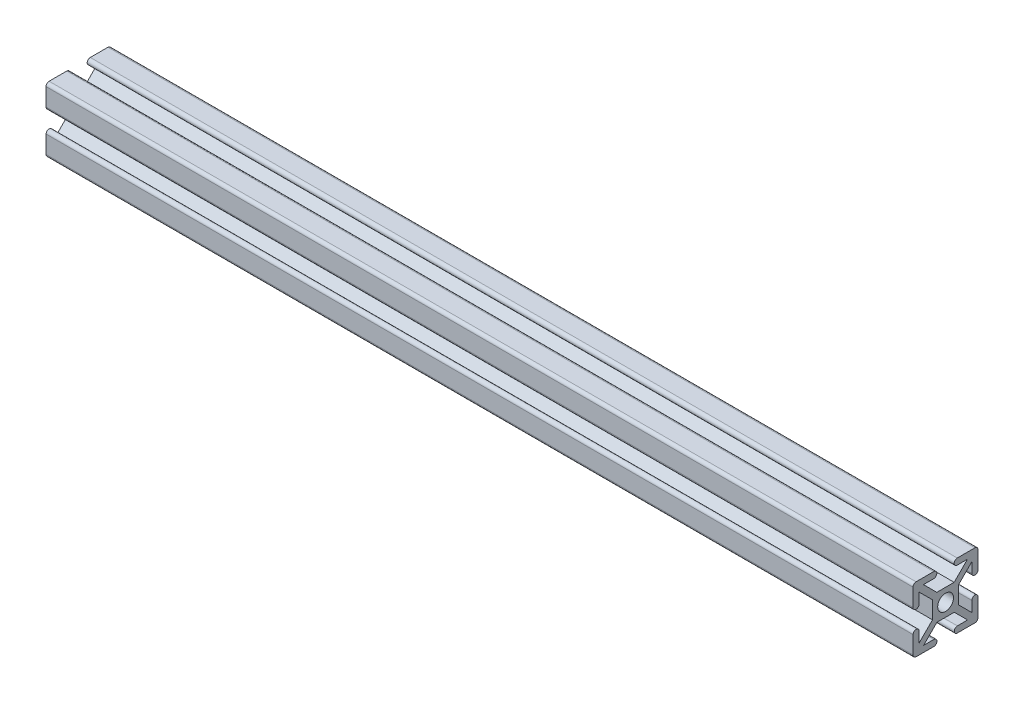
from build123d import *

# Parameters (mm, degrees)
CROQUIS1_R              = 3.645
SALIENTE_EXTRUIR1_DEPTH = 400


with BuildPart() as part:
    # Croquis1 → Saliente-Extruir1 (new body)
    with BuildSketch(Plane(origin=(0, 0, 0), x_dir=(0, 0, -1), z_dir=(1, 0, 0))):
        with BuildLine():
            Line((1.593856078, 3.684855586), (6.318856078, 3.684855586))
            Line((6.318856078, 3.684855586), (0.168856078, 9.834855586))
            Line((0.168856078, 9.834855586), (-7.831143922, 9.834855586))
            Line((-7.831143922, 9.834855586), (-13.981143922, 3.684855586))
            Line((-13.981143922, 3.684855586), (-9.256143922, 3.684855586))
            ThreePointArc((-9.256143922, 3.684855586), (-7.831143922, 2.259855586), (-9.256143922, 0.834855586))
            Line((-9.256143922, 0.834855586), (-17.432579695, 0.861291358))
            ThreePointArc((-17.432579695, 0.861291358), (-18.421513944, 1.270921337), (-18.831143922, 2.259855586))
            Line((-18.831143922, 2.259855586), (-18.831143922, 10.409855586))
            ThreePointArc((-18.831143922, 10.409855586), (-17.432579695, 11.808419813), (-16.034015468, 10.409855586))
            Line((-16.034015468, 10.409855586), (-16.034015468, 5.684855586))
            Line((-16.034015468, 5.684855586), (-9.884015468, 11.834855586))
            Line((-9.884015468, 11.834855586), (-9.884015468, 19.834855586))
            Line((-9.884015468, 19.834855586), (-16.034015468, 25.984855586))
            Line((-16.034015468, 25.984855586), (-16.034015468, 21.259855586))
            ThreePointArc((-16.034015468, 21.259855586), (-17.459015468, 19.834855586), (-18.884015468, 21.259855586))
            Line((-18.884015468, 21.259855586), (-18.884015468, 29.409808996))
            ThreePointArc((-18.884015468, 29.409808996), (-18.466642631, 30.417436159), (-17.459015468, 30.834808996))
            Line((-17.459015468, 30.834808996), (-9.309015468, 30.834808996))
            ThreePointArc((-9.309015468, 30.834808996), (-7.884015468, 29.409808996), (-9.309015468, 27.984808996))
            Line((-9.309015468, 27.984808996), (-14.034015468, 27.984808996))
            Line((-14.034015468, 27.984808996), (-7.884015468, 21.834808996))
            Line((-7.884015468, 21.834808996), (0.115984532, 21.834808996))
            Line((0.115984532, 21.834808996), (6.265984532, 27.984808996))
            Line((6.265984532, 27.984808996), (1.540984532, 27.984808996))
            ThreePointArc((1.540984532, 27.984808996), (0.115984532, 29.409808996), (1.540984532, 30.834808996))
            Line((1.540984532, 30.834808996), (9.690984532, 30.834808996))
            ThreePointArc((9.690984532, 30.834808996), (10.698611696, 30.417436159), (11.115984532, 29.409808996))
            Line((11.115984532, 29.409808996), (11.115984532, 21.363552681))
            ThreePointArc((11.115984532, 21.363552681), (9.690984532, 19.938552681), (8.265984532, 21.363552681))
            Line((8.265984532, 21.363552681), (8.265984532, 25.984808996))
            Line((8.265984532, 25.984808996), (2.115984532, 19.834808996))
            Line((2.115984532, 19.834808996), (2.115984532, 11.834808996))
            Line((2.115984532, 11.834808996), (8.265984532, 5.684808996))
            Line((8.265984532, 5.684808996), (8.265984532, 10.513552681))
            ThreePointArc((8.265984532, 10.513552681), (9.690984532, 11.938552681), (11.115984532, 10.513552681))
            Line((11.115984532, 10.513552681), (11.115984532, 2.259855586))
            ThreePointArc((11.115984532, 2.259855586), (10.698611696, 1.252228422), (9.690984532, 0.834855586))
            Line((9.690984532, 0.834855586), (1.593856078, 0.834855586))
            ThreePointArc((1.593856078, 0.834855586), (0.168856078, 2.259855586), (1.593856078, 3.684855586))
        make_face()
        with Locations((-3.831143922, 15.834855586)):
            Circle(CROQUIS1_R, mode=Mode.SUBTRACT)
    extrude(amount=SALIENTE_EXTRUIR1_DEPTH)


solid = part.part
